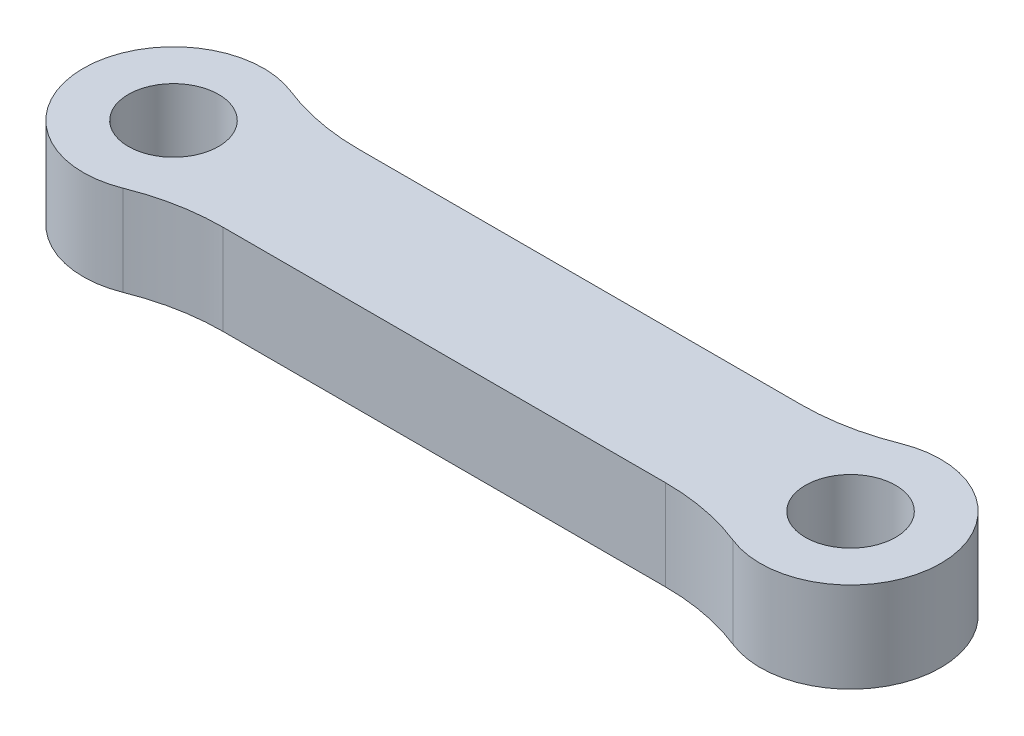
from build123d import *

# Parameters (mm, degrees)
ESQUISSE1_R        = 2
BOSS_EXTRU_1_DEPTH = 4
CONG_1_R           = 10


with BuildPart() as part:
    # Esquisse1 → Boss.-Extru.1 (new body)
    with BuildSketch(Plane(origin=(0, 0, 0), x_dir=(1, 0, 0), z_dir=(0, 1, 0))):
        with BuildLine():
            Line((2.645751311, 3), (27.354248689, 3))
            ThreePointArc((27.354248689, 3), (34, 0), (27.354248689, -3))
            Line((27.354248689, -3), (2.645751311, -3))
            ThreePointArc((2.645751311, -3), (-4, 0), (2.645751311, 3))
        make_face()
        with Locations(Location((0, 0, 0), (0, 0, 270))):
            Circle(ESQUISSE1_R, mode=Mode.SUBTRACT)
        with Locations(Location((30, 0, 0), (0, 0, 270))):
            Circle(ESQUISSE1_R, mode=Mode.SUBTRACT)
    extrude(amount=BOSS_EXTRU_1_DEPTH)

    # Congé1
    cong_1_edges = [part.edges().sort_by_distance(p)[0] for p in [
        (2.645751311, 2, -3),
        (27.354248689, 2, -3),
        (27.354248689, 2, 3),
        (2.645751311, 2, 3),
    ]]
    fillet(cong_1_edges, radius=CONG_1_R)


solid = part.part
